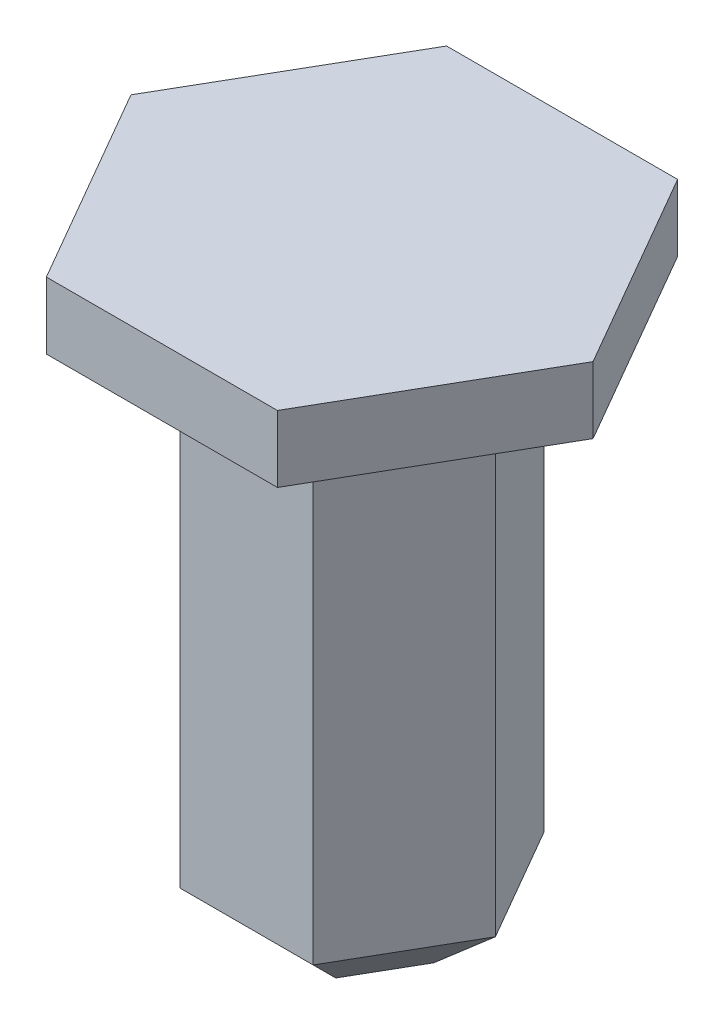
from build123d import *

# Parameters (mm, degrees)
BOSS_EXTRUDE1_DEPTH = 8
CHAMFER2_SIZE       = 0.8
BOSS_EXTRUDE2_DEPTH = 1


with BuildPart() as part:
    # Sketch1 → Boss-Extrude1 (new body)
    with BuildSketch(Plane(origin=(0, 0, 0), x_dir=(1, 0, 0), z_dir=(0, 1, 0))):
        Polygon((2, 0), (1, 1.732050808), (-1, 1.732050808), (-2, 0), (-1, -1.732050808), (1, -1.732050808), align=None)
    extrude(amount=BOSS_EXTRUDE1_DEPTH)

    # Chamfer2
    chamfer2_edges = [part.edges().sort_by_distance(p)[0] for p in [
        (0, 0, 1.732050808),
        (-1.5, 0, 0.866025404),
        (-1.5, 0, -0.866025404),
        (0, 0, -1.732050808),
        (1.5, 0, -0.866025404),
        (1.5, 0, 0.866025404),
    ]]
    chamfer(chamfer2_edges, length=CHAMFER2_SIZE)

    # Sketch2 → Boss-Extrude2 (add)
    with BuildSketch(Plane(origin=(0, 8, 0), x_dir=(1, 0, 0), z_dir=(0, 1, 0))):
        Polygon((-3.464101615, 0), (-1.732050808, -3), (1.732050808, -3), (3.464101615, 0), (1.732050808, 3), (-1.732050808, 3), align=None)
    extrude(amount=BOSS_EXTRUDE2_DEPTH)


solid = part.part
